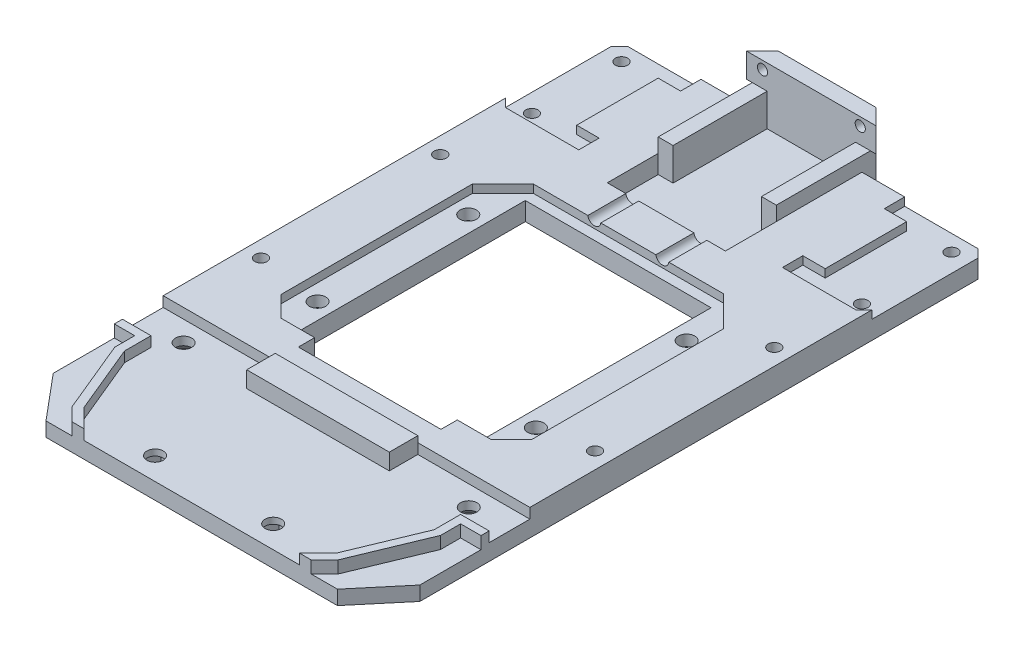
from build123d import *
from OCP.BRepFilletAPI import BRepFilletAPI_MakeChamfer

# Parameters (mm, degrees)
SKETCH1_W                                       = 90
SKETCH1_H                                       = 150
BOSS_EXTRUDE1_DEPTH                             = 6.5
CSK_FOR_M4_FLAT_HEAD_MACHINE_SCREW1_D           = 4
CSK_FOR_M4_FLAT_HEAD_MACHINE_SCREW1_DEPTH       = 38.798278762
CSK_FOR_M4_FLAT_HEAD_MACHINE_SCREW1_CSINK_D     = 7.9
CSK_FOR_M4_FLAT_HEAD_MACHINE_SCREW1_CSINK_ANGLE = 90
CSK_FOR_M4_FLAT_HEAD_MACHINE_SCREW1_TIP         = 1.201721238
SKETCH7_W                                       = 21.7
SKETCH7_H                                       = 24.512560893
CUT_EXTRUDE4_DEPTH                              = 4.5
CUT_EXTRUDE8_DEPTH                              = 88.705473033
CUT_EXTRUDE8_DEPTH_BACK                         = 88.705473033
CUT_EXTRUDE9_DEPTH                              = 88.705473033
CUT_EXTRUDE9_DEPTH_BACK                         = 88.705473033
SKETCH12_W                                      = 45.6
SKETCH12_H                                      = 57
CUT_EXTRUDE11_DEPTH                             = 88.705473033
CUT_EXTRUDE11_DEPTH_BACK                        = 2
CUT_EXTRUDE12_DEPTH                             = 2.5
CSK_FOR_M4_SFHCS1_AT_2_COUNT                    = 2
CSK_FOR_M4_SFHCS1_AT_2_PITCH                    = 37
CSK_FOR_M4_SFHCS1_AT_3_COUNT                    = 2
CSK_FOR_M4_SFHCS1_AT_3_PITCH                    = 65.130330876
CSK_FOR_M4_SFHCS1_AT_4_COUNT                    = 2
CSK_FOR_M4_SFHCS1_AT_4_PITCH                    = 53.6
SKETCH17_W                                      = 35
SKETCH17_H                                      = 7
BOSS_EXTRUDE2_DEPTH                             = 4
CUT_EXTRUDE13_DEPTH                             = 88.705473033
CUT_EXTRUDE13_DEPTH_BACK                        = 88.705473033
SKETCH18_W                                      = 35
SKETCH18_H                                      = 4
CUT_EXTRUDE14_DEPTH                             = 2
CSK_FOR_M3_SFHCS1_AT_2_COUNT                    = 2
CSK_FOR_M3_SFHCS1_AT_2_PITCH                    = 22
CSK_FOR_M3_SFHCS1_AT_3_COUNT                    = 2
CSK_FOR_M3_SFHCS1_AT_3_PITCH                    = 83.934498271
CSK_FOR_M3_SFHCS1_AT_4_COUNT                    = 2
CSK_FOR_M3_SFHCS1_AT_4_PITCH                    = 81
CSK_FOR_M3_SFHCS2_AT_2_COUNT                    = 2
CSK_FOR_M3_SFHCS2_AT_2_PITCH                    = 44
CSK_FOR_M3_SFHCS2_AT_3_COUNT                    = 2
CSK_FOR_M3_SFHCS2_AT_3_PITCH                    = 82
CSK_FOR_M3_SFHCS2_AT_4_COUNT                    = 2
CSK_FOR_M3_SFHCS2_AT_4_PITCH                    = 93.059120993
SKETCH24_W                                      = 29
SKETCH24_H                                      = 4.5
CUT_EXTRUDE15_DEPTH                             = 2
CSK_FOR_M4_SFHCS2_AT_2_COUNT                    = 2
CSK_FOR_M4_SFHCS2_AT_2_PITCH                    = 29
CHAMFER1_SIZE                                   = 2
SKETCH27_W                                      = 29
SKETCH27_H                                      = 12
BOSS_EXTRUDE3_DEPTH                             = 2
SKETCH28_W                                      = 3.65
SKETCH28_H                                      = 8
SKETCH28_H_2                                    = 2
BOSS_EXTRUDE4_DEPTH                             = 21
SKETCH29_R                                      = 1.6
CUT_EXTRUDE16_DEPTH                             = 9.323922895
BOSS_EXTRUDE5_DEPTH                             = 1
BOSS_EXTRUDE9_DEPTH                             = 1.5
BOSS_EXTRUDE10_DEPTH                            = 5
SKETCH36_W                                      = 21.7
SKETCH36_H                                      = 3.9
BOSS_EXTRUDE11_DEPTH                            = 8
CHAMFER4_SIZE                                   = 2.5
BOSS_EXTRUDE12_DEPTH                            = 6
F_1_0MM_DOWEL_HOLE1_D                           = 2.5
F_1_0MM_DOWEL_HOLE1_DEPTH                       = 5
F_1_0MM_DOWEL_HOLE1_TIP                         = 0.751075774
CHAMFER5_SIZE                                   = 11
CHAMFER5_SIZE2                                  = 9.230095943
CUT_EXTRUDE19_DEPTH                             = 0.5
CUT_EXTRUDE20_DEPTH                             = 2.5


with BuildPart() as part:
    # Sketch1 → Boss-Extrude1 (new body)
    with BuildSketch(Plane(origin=(0, 0, 0), x_dir=(1, 0, 0), z_dir=(0, 1, 0))):
        Rectangle(SKETCH1_W, SKETCH1_H)
    extrude(amount=BOSS_EXTRUDE1_DEPTH)

    # CSK for M4 Flat Head Machine Screw1
    with Locations(Plane(origin=(-695.683007616, 0, -1338.247292614), x_dir=(-1, 0, 0), z_dir=(0, -1, 0))):
        with Locations((-730.683007616, -1380.247292614), (-660.683007616, -1380.247292614)):
            CounterSinkHole(CSK_FOR_M4_FLAT_HEAD_MACHINE_SCREW1_D / 2, CSK_FOR_M4_FLAT_HEAD_MACHINE_SCREW1_CSINK_D / 2, depth=CSK_FOR_M4_FLAT_HEAD_MACHINE_SCREW1_DEPTH, counter_sink_angle=CSK_FOR_M4_FLAT_HEAD_MACHINE_SCREW1_CSINK_ANGLE)
            with Locations((0, 0, -(CSK_FOR_M4_FLAT_HEAD_MACHINE_SCREW1_DEPTH + CSK_FOR_M4_FLAT_HEAD_MACHINE_SCREW1_TIP / 2))):  # 118° drill point
                Cone(0, CSK_FOR_M4_FLAT_HEAD_MACHINE_SCREW1_D / 2, CSK_FOR_M4_FLAT_HEAD_MACHINE_SCREW1_TIP, mode=Mode.SUBTRACT)

    # Sketch7 → Cut-Extrude4 (cut)
    with BuildSketch(Plane(origin=(0, 6.5, 0), x_dir=(1, 0, 0), z_dir=(0, 1, 0))):
        with Locations((0, 62.743719554)):
            Rectangle(SKETCH7_W, SKETCH7_H)
    extrude(amount=-CUT_EXTRUDE4_DEPTH, mode=Mode.SUBTRACT)

    # Sketch11 → Cut-Extrude8 (cut, two sides: drawn at the far end of the back side and taken through both)
    with BuildSketch(Plane(origin=(0, 6.5, 0), x_dir=(1, 0, 0), z_dir=(0, 1, 0)).offset(-CUT_EXTRUDE8_DEPTH_BACK)):
        Polygon((-10.85, 75), (-14.5, 75), (-14.5, 42), (14.5, 42), (14.5, 75), (10.85, 75), (10.85, 50.487439107), (-10.85, 50.487439107), align=None)
    extrude(amount=CUT_EXTRUDE8_DEPTH + CUT_EXTRUDE8_DEPTH_BACK, mode=Mode.SUBTRACT)


with BuildPart() as cut_extrude8_piece_1:
    # of the separate pieces the step leaves, piece 1, a body of its own (cut_extrude8_pieces)
    add(part.part.solids().sort_by_distance((-45, 0, -75))[0])

    # Sketch12 → Cut-Extrude9 (cut, two sides: drawn at the far end of the back side and taken through both)
    with BuildSketch(Plane(origin=(0, 6.5, 0), x_dir=(1, 0, 0), z_dir=(0, 1, 0)).offset(-CUT_EXTRUDE9_DEPTH_BACK)):
        with Locations((0, 1.176077105)):
            Rectangle(SKETCH12_W, SKETCH12_H)
    extrude(amount=CUT_EXTRUDE9_DEPTH + CUT_EXTRUDE9_DEPTH_BACK, mode=Mode.SUBTRACT)

    # Sketch14 → Cut-Extrude11 (cut, two sides: drawn at the far end of the back side and taken through both)
    with BuildSketch(Plane(origin=(0, 6.5, 0), x_dir=(1, 0, 0), z_dir=(0, 1, 0)).offset(-CUT_EXTRUDE11_DEPTH_BACK)):
        Polygon((-22.8, -27.323922895), (-22.8, 29.676077105), (22.8, 29.676077105), (22.8, -27.323922895), (25.8, -27.323922895), (30.8, -22.323922895), (30.8, 24.676077105), (23.3, 32.176077105), (-23.3, 32.176077105), (-30.8, 24.676077105), (-30.8, -22.323922895), (-25.8, -27.323922895), align=None)
    extrude(amount=CUT_EXTRUDE11_DEPTH + CUT_EXTRUDE11_DEPTH_BACK, mode=Mode.SUBTRACT)

    # Sketch2 → Cut-Extrude12 (cut)
    with BuildSketch(Plane(origin=(0, 6.5, 0), x_dir=(1, 0, 0), z_dir=(0, 1, 0))):
        Polygon((-38, -47), (-45, -47), (-45, -37), (45, -37), (45, -47), (38, -47), (38, -53.5), (30.928932188, -70.571067812), (26.5, -75), (-26.5, -75), (-30.928932188, -70.571067812), (-38, -53.5), align=None)
        Polygon((-32.624450318, -71.703976807), (-29.328427125, -75), (-45, -75), (-45, -49), (-40, -49), (-40, -53.897824735), align=None)
        Polygon((29.328427125, -75), (32.624450318, -71.703976807), (40, -53.897824735), (40, -49), (45, -49), (45, -75), align=None)
    extrude(amount=-CUT_EXTRUDE12_DEPTH, mode=Mode.SUBTRACT)

    # Sketch16 → CSK for M4 SFHCS1 (revolve, cut)
    with BuildSketch(Plane(origin=(-26.8, 0, 17.323922895), x_dir=(0, 0, -1), z_dir=(1, 0, 0))):
        Polygon((0, 0), (0, 26.701721238), (2, 25.5), (2, 1.8), (3.8, 0), align=None)
    csk_for_m4_sfhcs1 = revolve(axis=Axis((-26.8, -6.35, 17.323922895), (0, 1, 0)), mode=Mode.SUBTRACT)

    # CSK for M4 SFHCS1 at 2: CSK for M4 SFHCS1 ×2
    with Locations(*[(0, 0, -i * CSK_FOR_M4_SFHCS1_AT_2_PITCH) for i in range(1, CSK_FOR_M4_SFHCS1_AT_2_COUNT)]):
        add(csk_for_m4_sfhcs1, mode=Mode.SUBTRACT)

    # CSK for M4 SFHCS1 at 3: CSK for M4 SFHCS1 ×2
    with Locations(*[Vector(0.8229652648649476, 0, -0.5680916940299047) * (i * CSK_FOR_M4_SFHCS1_AT_3_PITCH) for i in range(1, CSK_FOR_M4_SFHCS1_AT_3_COUNT)]):
        add(csk_for_m4_sfhcs1, mode=Mode.SUBTRACT)

    # CSK for M4 SFHCS1 at 4: CSK for M4 SFHCS1 ×2
    with Locations(*[(i * CSK_FOR_M4_SFHCS1_AT_4_PITCH, 0, 0) for i in range(1, CSK_FOR_M4_SFHCS1_AT_4_COUNT)]):
        add(csk_for_m4_sfhcs1, mode=Mode.SUBTRACT)

    # Sketch17 → Boss-Extrude2 (add)
    with BuildSketch(Plane(origin=(0, 4, 0), x_dir=(1, 0, 0), z_dir=(0, 1, 0))):
        with Locations((0, -40.5)):
            Rectangle(SKETCH17_W, SKETCH17_H)
    extrude(amount=BOSS_EXTRUDE2_DEPTH)

    # Sketch18 → Cut-Extrude13 (cut, two sides: drawn at the far end of the back side and taken through both)
    with BuildSketch(Plane(origin=(0, 6.5, 0), x_dir=(1, 0, 0), z_dir=(0, 1, 0)).offset(-CUT_EXTRUDE13_DEPTH_BACK)):
        with Locations((0, -29.323922895)):
            Rectangle(SKETCH18_W, SKETCH18_H)
    extrude(amount=CUT_EXTRUDE13_DEPTH + CUT_EXTRUDE13_DEPTH_BACK, mode=Mode.SUBTRACT)

    # Sketch19 → Cut-Extrude14 (cut)
    with BuildSketch(Plane(origin=(0, 6.5, 0), x_dir=(1, 0, 0), z_dir=(0, 1, 0))):
        Polygon((25, 70), (30.5, 70), (30.5, 50), (25, 50), (25, 45), (43, 45), (45, 47), (45, 75), (25, 75), align=None)
        Polygon((-25, 50), (-30.5, 50), (-30.5, 70), (-25, 70), (-25, 75), (-45, 75), (-45, 47), (-43, 45), (-25, 45), align=None)
    extrude(amount=-CUT_EXTRUDE14_DEPTH, mode=Mode.SUBTRACT)

    # Sketch21 → CSK for M3 SFHCS1 (revolve, cut)
    with BuildSketch(Plane(origin=(40.5, 0, -71), x_dir=(0, 0, -1), z_dir=(1, 0, 0))):
        Polygon((0, 0), (0, 5.901290929), (1.5, 5), (1.5, 1.86), (3.36, 0), align=None)
    csk_for_m3_sfhcs1 = revolve(axis=Axis((40.5, -6.35, -71), (0, 1, 0)), mode=Mode.SUBTRACT)

    # CSK for M3 SFHCS1 at 2: CSK for M3 SFHCS1 ×2
    with Locations(*[(0, 0, i * CSK_FOR_M3_SFHCS1_AT_2_PITCH) for i in range(1, CSK_FOR_M3_SFHCS1_AT_2_COUNT)]):
        add(csk_for_m3_sfhcs1, mode=Mode.SUBTRACT)

    # CSK for M3 SFHCS1 at 3: CSK for M3 SFHCS1 ×2
    with Locations(*[Vector(-0.9650382342013949, 0, 0.2621091500300089) * (i * CSK_FOR_M3_SFHCS1_AT_3_PITCH) for i in range(1, CSK_FOR_M3_SFHCS1_AT_3_COUNT)]):
        add(csk_for_m3_sfhcs1, mode=Mode.SUBTRACT)

    # CSK for M3 SFHCS1 at 4: CSK for M3 SFHCS1 ×2
    with Locations(*[(-i * CSK_FOR_M3_SFHCS1_AT_4_PITCH, 0, 0) for i in range(1, CSK_FOR_M3_SFHCS1_AT_4_COUNT)]):
        add(csk_for_m3_sfhcs1, mode=Mode.SUBTRACT)

    # Sketch23 → CSK for M3 SFHCS2 (revolve, cut)
    with BuildSketch(Plane(origin=(-41, 0, 17), x_dir=(0, 0, -1), z_dir=(1, 0, 0))):
        Polygon((0, 0), (0, 10.901290929), (1.5, 10), (1.5, 1.7), (3.2, 0), align=None)
    csk_for_m3_sfhcs2 = revolve(axis=Axis((-41, -6.35, 17), (0, 1, 0)), mode=Mode.SUBTRACT)

    # CSK for M3 SFHCS2 at 2: CSK for M3 SFHCS2 ×2
    with Locations(*[(0, 0, -i * CSK_FOR_M3_SFHCS2_AT_2_PITCH) for i in range(1, CSK_FOR_M3_SFHCS2_AT_2_COUNT)]):
        add(csk_for_m3_sfhcs2, mode=Mode.SUBTRACT)

    # CSK for M3 SFHCS2 at 3: CSK for M3 SFHCS2 ×2
    with Locations(*[(i * CSK_FOR_M3_SFHCS2_AT_3_PITCH, 0, 0) for i in range(1, CSK_FOR_M3_SFHCS2_AT_3_COUNT)]):
        add(csk_for_m3_sfhcs2, mode=Mode.SUBTRACT)

    # CSK for M3 SFHCS2 at 4: CSK for M3 SFHCS2 ×2
    with Locations(*[Vector(0.8811602680635651, 0, -0.4728177048146) * (i * CSK_FOR_M3_SFHCS2_AT_4_PITCH) for i in range(1, CSK_FOR_M3_SFHCS2_AT_4_COUNT)]):
        add(csk_for_m3_sfhcs2, mode=Mode.SUBTRACT)

    # Sketch24 → Cut-Extrude15 (cut)
    with BuildSketch(Plane(origin=(0, 0, -42), x_dir=(-1, 0, 0), z_dir=(0, 0, -1))):
        with Locations((0, 4.25)):
            Rectangle(SKETCH24_W, SKETCH24_H)
    extrude(amount=-CUT_EXTRUDE15_DEPTH, mode=Mode.SUBTRACT)

    # Sketch26 → CSK for M4 SFHCS2 (revolve, cut)
    with BuildSketch(Plane(origin=(-14.5, 11, 69.5), x_dir=(0, 0, 1), z_dir=(1, 0, 0))):
        Polygon((0, 0), (0, 12.201721238), (2, 11), (2, 1.8), (3.8, 0), align=None)
    csk_for_m4_sfhcs2 = revolve(axis=Axis((-14.5, 17.35, 69.5), (0, -1, 0)), mode=Mode.SUBTRACT)

    # CSK for M4 SFHCS2 at 2: CSK for M4 SFHCS2 ×2
    with Locations(*[(i * CSK_FOR_M4_SFHCS2_AT_2_PITCH, 0, 0) for i in range(1, CSK_FOR_M4_SFHCS2_AT_2_COUNT)]):
        add(csk_for_m4_sfhcs2, mode=Mode.SUBTRACT)

    # Chamfer1
    chamfer1_edges = [cut_extrude8_piece_1.edges().sort_by_distance(p)[0] for p in [
        (45, 2.25, -75),
        (-45, 2.25, -75),
    ]]
    chamfer(chamfer1_edges, length=CHAMFER1_SIZE)

    # Sketch27 → Boss-Extrude3 (add)
    with BuildSketch(Plane.XZ):
        with Locations((0, -48)):
            Rectangle(SKETCH27_W, SKETCH27_H)
    extrude(amount=-BOSS_EXTRUDE3_DEPTH)


with BuildPart() as cut_extrude8_piece_2:
    # of the separate pieces the step leaves, piece 2, a body of its own (cut_extrude8_pieces)
    add(part.part.solids().sort_by_distance((10.85, 0, -75))[0])

    # Combine1: union Cut-Extrude8 piece 1
    add(cut_extrude8_piece_1.part)

    # Sketch28 → Boss-Extrude4 (add)
    with BuildSketch(Plane(origin=(0, 0, -54), x_dir=(-1, 0, 0), z_dir=(0, 0, -1))):
        with Locations((-12.675, 6)):
            Rectangle(SKETCH28_W, SKETCH28_H)
        with Locations((12.675, 1)):
            Rectangle(SKETCH28_W, SKETCH28_H_2)
        with Locations((12.675, 6)):
            Rectangle(SKETCH28_W, SKETCH28_H)
        with Locations((-12.675, 1)):
            Rectangle(SKETCH28_W, SKETCH28_H_2)
    extrude(amount=BOSS_EXTRUDE4_DEPTH)

    # Sketch29 → Cut-Extrude16 (cut)
    with BuildSketch(Plane.XY.offset(-32.176077105)):
        with BuildLine():
            ThreePointArc((9.95, 6.7), (8.24980334, 8.296859615), (6.762549213, 6.5))
            Line((6.762549213, 6.5), (7.116103732, 6.5))
            ThreePointArc((7.116103732, 6.5), (8.249676361, 7.945967563), (9.6, 6.7))
            ThreePointArc((9.6, 6.7), (9.595967563, 6.599676361), (9.583896268, 6.5))
            Line((9.583896268, 6.5), (9.937450787, 6.5))
            ThreePointArc((9.937450787, 6.5), (9.946859615, 6.59980334), (9.95, 6.7))
        make_face()
        with BuildLine():
            Line((7.116103732, 6.5), (6.762549213, 6.5))
            ThreePointArc((6.762549213, 6.5), (8.35, 5.1), (9.937450787, 6.5))
            Line((9.937450787, 6.5), (9.583896268, 6.5))
            ThreePointArc((9.583896268, 6.5), (8.35, 5.45), (7.116103732, 6.5))
        make_face()
        with BuildLine():
            ThreePointArc((9.95, 6.7), (8.24980334, 8.296859615), (6.762549213, 6.5))
            Line((6.762549213, 6.5), (7.116103732, 6.5))
            ThreePointArc((7.116103732, 6.5), (8.249676361, 7.945967563), (9.6, 6.7))
            ThreePointArc((9.6, 6.7), (9.595967563, 6.599676361), (9.583896268, 6.5))
            Line((9.583896268, 6.5), (9.937450787, 6.5))
            ThreePointArc((9.937450787, 6.5), (9.946859615, 6.59980334), (9.95, 6.7))
        make_face()
        with BuildLine():
            Line((7.116103732, 6.5), (6.762549213, 6.5))
            ThreePointArc((6.762549213, 6.5), (8.35, 5.1), (9.937450787, 6.5))
            Line((9.937450787, 6.5), (9.583896268, 6.5))
            ThreePointArc((9.583896268, 6.5), (8.35, 5.45), (7.116103732, 6.5))
        make_face()
        with BuildLine():
            Line((9.583896268, 6.5), (7.116103732, 6.5))
            ThreePointArc((7.116103732, 6.5), (8.35, 5.45), (9.583896268, 6.5))
        make_face()
        with BuildLine():
            ThreePointArc((9.6, 6.7), (8.249676361, 7.945967563), (7.116103732, 6.5))
            Line((7.116103732, 6.5), (9.583896268, 6.5))
            ThreePointArc((9.583896268, 6.5), (9.595967563, 6.599676361), (9.6, 6.7))
        make_face()
        with BuildLine():
            Line((9.583896268, 6.5), (7.116103732, 6.5))
            ThreePointArc((7.116103732, 6.5), (8.35, 5.45), (9.583896268, 6.5))
        make_face()
        with BuildLine():
            ThreePointArc((9.6, 6.7), (8.249676361, 7.945967563), (7.116103732, 6.5))
            Line((7.116103732, 6.5), (9.583896268, 6.5))
            ThreePointArc((9.583896268, 6.5), (9.595967563, 6.599676361), (9.6, 6.7))
        make_face()
        with Locations((-8.35, 6.7)):
            Circle(SKETCH29_R)
    extrude(amount=-CUT_EXTRUDE16_DEPTH, mode=Mode.SUBTRACT)

    # Sketch30 → Boss-Extrude5 (add)
    with BuildSketch(Plane(origin=(0, 0, -75), x_dir=(-1, 0, 0), z_dir=(0, 0, -1))):
        Polygon((-14.5, 10), (-14.5, 0), (14.5, 0), (14.5, 10), (10.85, 10), (10.85, 2), (-10.85, 2), (-10.85, 10), align=None)
    extrude(amount=BOSS_EXTRUDE5_DEPTH)

    # Sketch34 → Boss-Extrude9 (add)
    with BuildSketch(Plane(origin=(0, 0, -40), x_dir=(-1, 0, 0), z_dir=(0, 0, -1))):
        with BuildLine():
            Line((6.762549213, 6.5), (-6.762549213, 6.5))
            ThreePointArc((-6.762549213, 6.5), (-8.35, 5.1), (-9.937450787, 6.5))
            Line((-9.937450787, 6.5), (-14.5, 6.5))
            Line((-14.5, 6.5), (-14.5, 2))
            Line((-14.5, 2), (14.5, 2))
            Line((14.5, 2), (14.5, 6.5))
            Line((14.5, 6.5), (9.937450787, 6.5))
            ThreePointArc((9.937450787, 6.5), (8.35, 5.1), (6.762549213, 6.5))
        make_face()
    extrude(amount=BOSS_EXTRUDE9_DEPTH)

    # Sketch35 → Boss-Extrude10 (add)
    with BuildSketch(Plane(origin=(0, 0, -76), x_dir=(-1, 0, 0), z_dir=(0, 0, -1))):
        Polygon((-10.85, 10), (-14.5, 10), (-14.5, 0), (14.5, 0), (14.5, 10), (10.85, 10), (10.85, 2), (-10.85, 2), align=None)
    extrude(amount=BOSS_EXTRUDE10_DEPTH)

    # Sketch36 → Boss-Extrude11 (add)
    with BuildSketch(Plane(origin=(0, 2, 0), x_dir=(1, 0, 0), z_dir=(0, 1, 0))):
        with Locations((0, 79.05)):
            Rectangle(SKETCH36_W, SKETCH36_H)
    extrude(amount=BOSS_EXTRUDE11_DEPTH)

    # Chamfer4
    chamfer4_edges = [cut_extrude8_piece_2.edges().sort_by_distance(p)[0] for p in [
        (14.5, 5, -81),
        (-14.5, 5, -81),
    ]]
    chamfer(chamfer4_edges, length=CHAMFER4_SIZE)

    # Sketch37 → Boss-Extrude12 (add)
    with BuildSketch(Plane(origin=(0, 10, 0), x_dir=(1, 0, 0), z_dir=(0, 1, 0))):
        Polygon((-10.85, 77.1), (-15.9, 77.1), (-12, 81), (12, 81), (15.9, 77.1), align=None)
    extrude(amount=BOSS_EXTRUDE12_DEPTH)

    # Ø1.0mm Dowel Hole1
    with Locations(Plane(origin=(0, 0, -81), x_dir=(-1, 0, 0), z_dir=(0, 0, -1))):
        with Locations((-12, 14), (12, 14)):
            Hole(F_1_0MM_DOWEL_HOLE1_D / 2, depth=F_1_0MM_DOWEL_HOLE1_DEPTH)
            with Locations((0, 0, -(F_1_0MM_DOWEL_HOLE1_DEPTH + F_1_0MM_DOWEL_HOLE1_TIP / 2))):  # 118° drill point
                Cone(0, F_1_0MM_DOWEL_HOLE1_D / 2, F_1_0MM_DOWEL_HOLE1_TIP, mode=Mode.SUBTRACT)

    # Chamfer5: one chamfer whose edges measure the first distance from different faces: ONE call of the kernel's chamfer builder (chamfer() names one face for all edges)
    chamfer5_edges_1 = [cut_extrude8_piece_2.edges().sort_by_distance(p)[0] for p in [
        (45, 2, 75),
    ]]
    chamfer5_side_1 = [cut_extrude8_piece_2.faces().sort_by_distance(p)[0] for p in [
        (45, 2.887804878, -1.217073171),
    ]]
    chamfer5_edges_2 = [cut_extrude8_piece_2.edges().sort_by_distance(p)[0] for p in [
        (-45, 2, 75),
    ]]
    chamfer5_side_2 = [cut_extrude8_piece_2.faces().sort_by_distance(p)[0] for p in [
        (-45, 2.887804878, -1.217073171),
    ]]
    chamfer5 = BRepFilletAPI_MakeChamfer(cut_extrude8_piece_2.part.solid().wrapped)
    for e in chamfer5_edges_1:
        chamfer5.Add(CHAMFER5_SIZE, CHAMFER5_SIZE2, e.wrapped, chamfer5_side_1[0].wrapped)  # the first distance lies on this face
    for e in chamfer5_edges_2:
        chamfer5.Add(CHAMFER5_SIZE, CHAMFER5_SIZE2, e.wrapped, chamfer5_side_2[0].wrapped)  # the first distance lies on this face
    add(Compound.cast(chamfer5.Shape()), mode=Mode.REPLACE)

    # Sketch40 → Cut-Extrude19 (cut)
    with BuildSketch(Plane(origin=(0, 4, 0), x_dir=(1, 0, 0), z_dir=(0, 1, 0))):
        Polygon((29.328427125, -75), (35.769904057, -75), (45, -64), (45, -49), (40, -49), (40, -53.897824735), (32.624450318, -71.703976807), align=None)
        Polygon((-45, -49), (-45, -64), (-35.769904057, -75), (-29.328427125, -75), (-32.624450318, -71.703976807), (-40, -53.897824735), (-40, -49), align=None)
    extrude(amount=-CUT_EXTRUDE19_DEPTH, mode=Mode.SUBTRACT)

    # Sketch41 → Cut-Extrude20 (cut)
    with BuildSketch(Plane.XZ):
        Polygon((-10.516283143, 69.5), (-12.508141571, 72.95), (-16.491858429, 72.95), (-18.483716857, 69.5), (-16.491858429, 66.05), (-12.508141571, 66.05), align=None)
        Polygon((10.516283143, 69.5), (12.508141571, 66.05), (16.491858429, 66.05), (18.483716857, 69.5), (16.491858429, 72.95), (12.508141571, 72.95), align=None)
    extrude(amount=-CUT_EXTRUDE20_DEPTH, mode=Mode.SUBTRACT)


solid = cut_extrude8_piece_2.part
